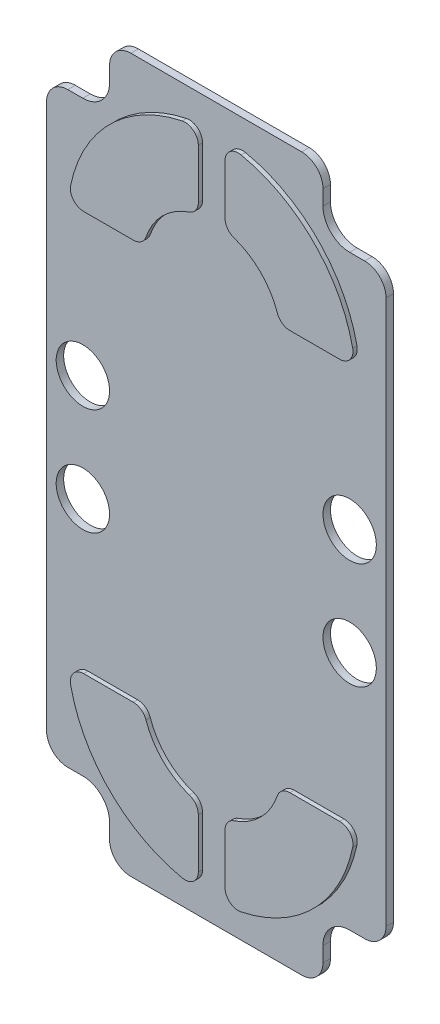
from build123d import *

# Parameters (mm, degrees)
SKETCH1_R           = 5
BOSS_EXTRUDE1_DEPTH = 1.4
BOSS_EXTRUDE2_DEPTH = 0.8


with BuildPart() as part:
    # Sketch1 → Boss-Extrude1 (new body)
    with BuildSketch(Plane.XY):
        with BuildLine():
            Line((20, 60), (20, 62.81))
            ThreePointArc((20, 62.81), (18.828427125, 65.638427125), (16, 66.81))
            Line((16, 66.81), (-16, 66.81))
            ThreePointArc((-16, 66.81), (-18.828427125, 65.638427125), (-20, 62.81))
            Line((-20, 62.81), (-20, 60))
            ThreePointArc((-20, 60), (-21.464466094, 56.464466094), (-25, 55))
            Line((-25, 55), (-27.81, 55))
            ThreePointArc((-27.81, 55), (-30.638427125, 53.828427125), (-31.81, 51))
            Line((-31.81, 51), (-31.81, -51))
            ThreePointArc((-31.81, -51), (-30.638427125, -53.828427125), (-27.81, -55))
            Line((-27.81, -55), (-25, -55))
            ThreePointArc((-25, -55), (-21.464466094, -56.464466094), (-20, -60))
            Line((-20, -60), (-20, -62.81))
            ThreePointArc((-20, -62.81), (-18.828427125, -65.638427125), (-16, -66.81))
            Line((-16, -66.81), (16, -66.81))
            ThreePointArc((16, -66.81), (18.828427125, -65.638427125), (20, -62.81))
            Line((20, -62.81), (20, -60))
            ThreePointArc((20, -60), (21.464466094, -56.464466094), (25, -55))
            Line((25, -55), (27.81, -55))
            ThreePointArc((27.81, -55), (30.638427125, -53.828427125), (31.81, -51))
            Line((31.81, -51), (31.81, 51))
            ThreePointArc((31.81, 51), (30.638427125, 53.828427125), (27.81, 55))
            Line((27.81, 55), (25, 55))
            ThreePointArc((25, 55), (21.464466094, 56.464466094), (20, 60))
        make_face()
        with Locations((-25, 10)):
            Circle(SKETCH1_R, mode=Mode.SUBTRACT)
        with Locations((25, 10)):
            Circle(SKETCH1_R, mode=Mode.SUBTRACT)
        with Locations((-25, -10)):
            Circle(SKETCH1_R, mode=Mode.SUBTRACT)
        with Locations((25, -10)):
            Circle(SKETCH1_R, mode=Mode.SUBTRACT)
    extrude(amount=BOSS_EXTRUDE1_DEPTH)

    # Sketch2 → Boss-Extrude2 (add)
    with BuildSketch(Plane.XY.offset(1.4)):
        with BuildLine():
            Line((-24.048951294, 37.5), (-14.735982135, 37.5))
            ThreePointArc((-14.735982135, 37.5), (-13.281012897, 37.967006022), (-12.369627175, 39.193548387))
            ThreePointArc((-12.369627175, 39.193548387), (-9.256969539, 44.192388155), (-4.258129771, 47.305045791))
            ThreePointArc((-4.258129771, 47.305045791), (-3.031587405, 48.216431513), (-2.564581384, 49.671400751))
            Line((-2.564581384, 49.671400751), (-2.564581384, 58.98436991))
            ThreePointArc((-2.564581384, 58.98436991), (-3.487481229, 60.924152141), (-5.574785465, 61.431754595))
            ThreePointArc((-5.574785465, 61.431754595), (-19.156464476, 54.091883092), (-26.496335979, 40.510204082))
            ThreePointArc((-26.496335979, 40.510204082), (-25.988733525, 38.422899845), (-24.048951294, 37.5))
        make_face()
        with BuildLine():
            Line((23.919788527, 37.5), (14.606819368, 37.5))
            ThreePointArc((14.606819368, 37.5), (13.151850129, 37.967006022), (12.240464408, 39.193548387))
            ThreePointArc((12.240464408, 39.193548387), (9.127806772, 44.192388155), (4.128967004, 47.305045791))
            ThreePointArc((4.128967004, 47.305045791), (2.902424638, 48.216431513), (2.435418616, 49.671400751))
            Line((2.435418616, 49.671400751), (2.435418616, 58.98436991))
            ThreePointArc((2.435418616, 58.98436991), (3.358318462, 60.924152141), (5.445622698, 61.431754595))
            ThreePointArc((5.445622698, 61.431754595), (19.027301709, 54.091883092), (26.367173212, 40.510204082))
            ThreePointArc((26.367173212, 40.510204082), (25.859570757, 38.422899845), (23.919788527, 37.5))
        make_face()
        with BuildLine():
            Line((-24.048951294, -37.5), (-14.735982135, -37.5))
            ThreePointArc((-14.735982135, -37.5), (-13.281012897, -37.967006022), (-12.369627175, -39.193548387))
            ThreePointArc((-12.369627175, -39.193548387), (-9.256969539, -44.192388155), (-4.258129771, -47.305045791))
            ThreePointArc((-4.258129771, -47.305045791), (-3.031587405, -48.216431513), (-2.564581384, -49.671400751))
            Line((-2.564581384, -49.671400751), (-2.564581384, -58.98436991))
            ThreePointArc((-2.564581384, -58.98436991), (-3.487481229, -60.924152141), (-5.574785465, -61.431754595))
            ThreePointArc((-5.574785465, -61.431754595), (-19.156464476, -54.091883092), (-26.496335979, -40.510204082))
            ThreePointArc((-26.496335979, -40.510204082), (-25.988733525, -38.422899845), (-24.048951294, -37.5))
        make_face()
        with BuildLine():
            Line((2.435418616, -49.671400751), (2.435418616, -58.98436991))
            ThreePointArc((2.435418616, -58.98436991), (3.358318462, -60.924152141), (5.445622698, -61.431754595))
            ThreePointArc((5.445622698, -61.431754595), (19.027301709, -54.091883092), (26.367173212, -40.510204082))
            ThreePointArc((26.367173212, -40.510204082), (25.859570757, -38.422899845), (23.919788527, -37.5))
            Line((23.919788527, -37.5), (14.606819368, -37.5))
            ThreePointArc((14.606819368, -37.5), (13.151850129, -37.967006022), (12.240464408, -39.193548387))
            ThreePointArc((12.240464408, -39.193548387), (9.127806772, -44.192388155), (4.128967004, -47.305045791))
            ThreePointArc((4.128967004, -47.305045791), (2.902424638, -48.216431513), (2.435418616, -49.671400751))
        make_face()
    extrude(amount=BOSS_EXTRUDE2_DEPTH)


solid = part.part
